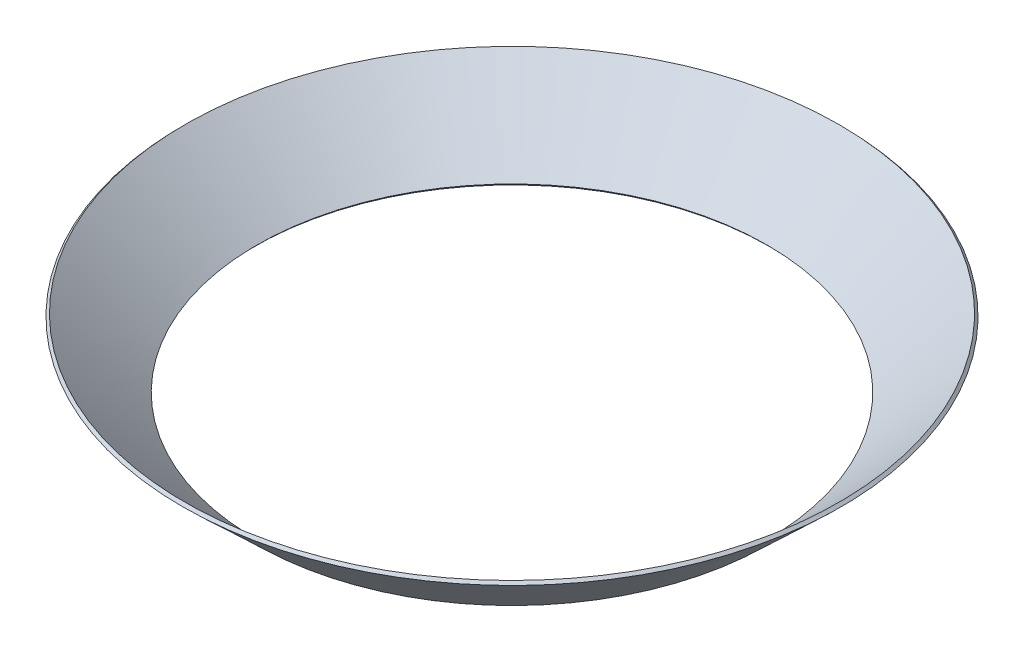
from build123d import *


with BuildPart() as part:
    # reflector → Revolve10 (revolve)
    with BuildSketch(Plane(origin=(0, 0, 0), x_dir=(0, 0, -1), z_dir=(1, 0, 0))):
        Polygon((36.026073869, 309.426421451), (35.681896581, 309.789108636), (45.748610472, 319.342063422), (46.09278776, 318.979376237), align=None)
    revolve(axis=Axis((0, 0, 0), (0, 1, 0)))


solid = part.part
